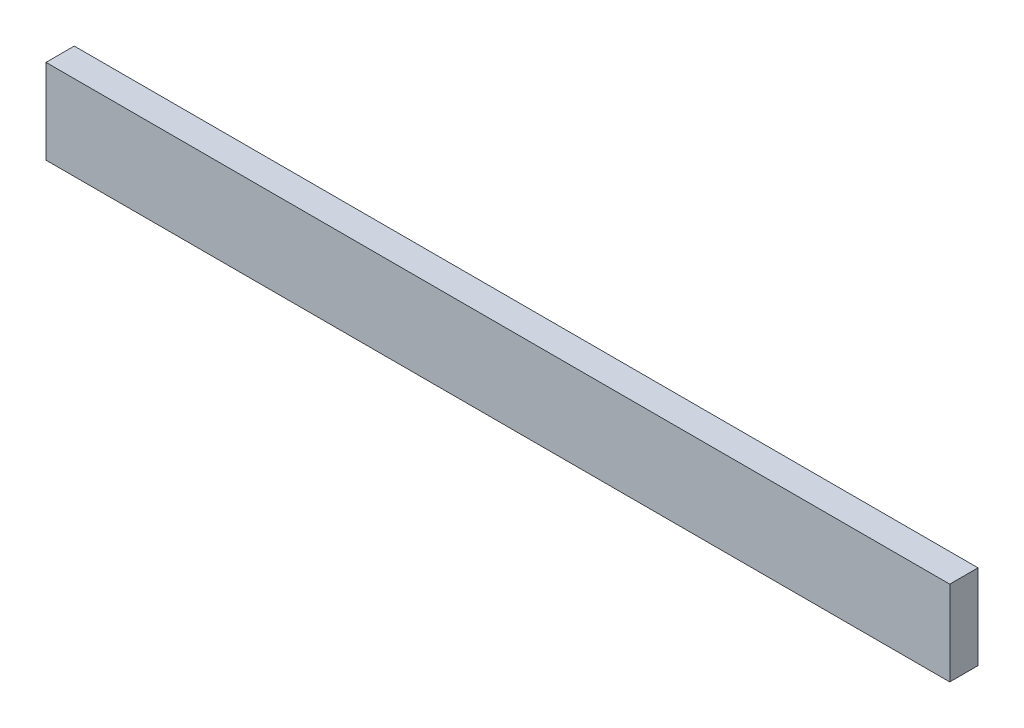
from build123d import *

# Parameters (mm, degrees)
SKETCH1_W           = 101.6
SKETCH1_H           = 9.525
BOSS_EXTRUDE1_DEPTH = 3.175


with BuildPart() as part:
    # Sketch1 → Boss-Extrude1 (new body)
    with BuildSketch(Plane.XY):
        with Locations((-11.225756214, -1.465153764)):
            Rectangle(SKETCH1_W, SKETCH1_H)
    extrude(amount=BOSS_EXTRUDE1_DEPTH)


solid = part.part
